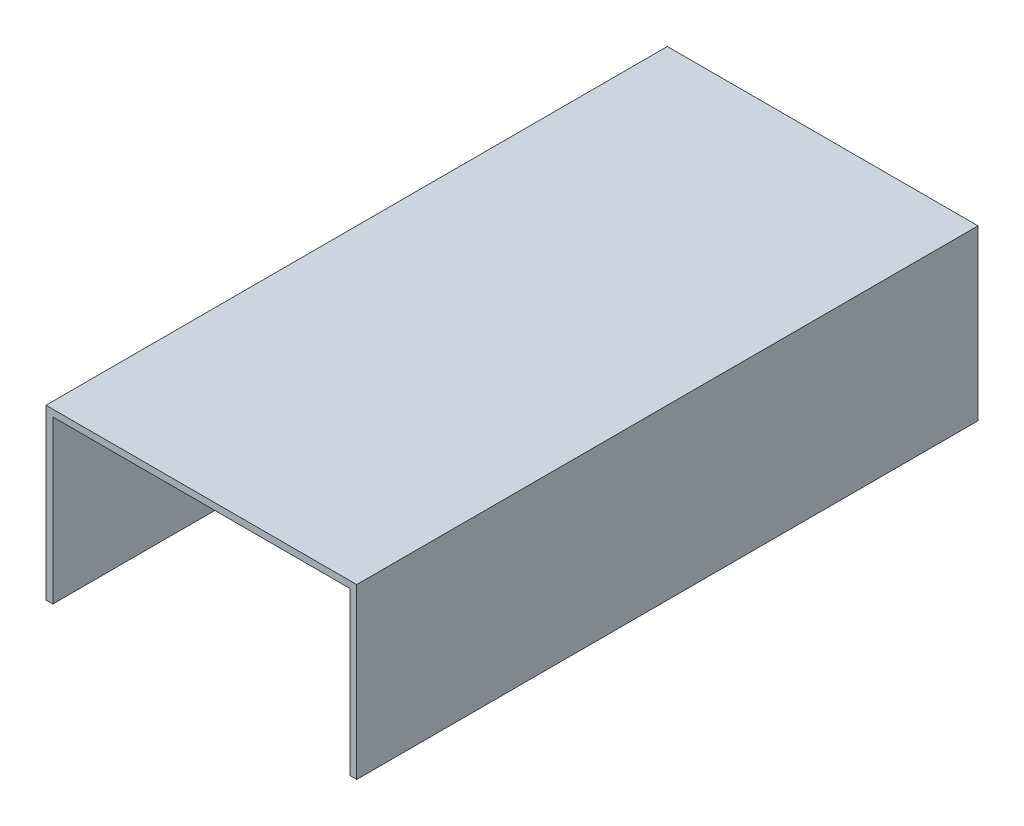
from build123d import *

# Parameters (mm, degrees)
BOSS_EXTRUDE1_DEPTH = 292.1


with BuildPart() as part:
    # Sketch1 → Boss-Extrude1 (new body)
    with BuildSketch(Plane.XY):
        Polygon((0, 79.375), (0, 0), (3.175, 0), (3.175, 76.2), (142.875, 76.2), (142.875, 0), (146.05, 0), (146.05, 79.375), align=None)
    extrude(amount=BOSS_EXTRUDE1_DEPTH)


solid = part.part
